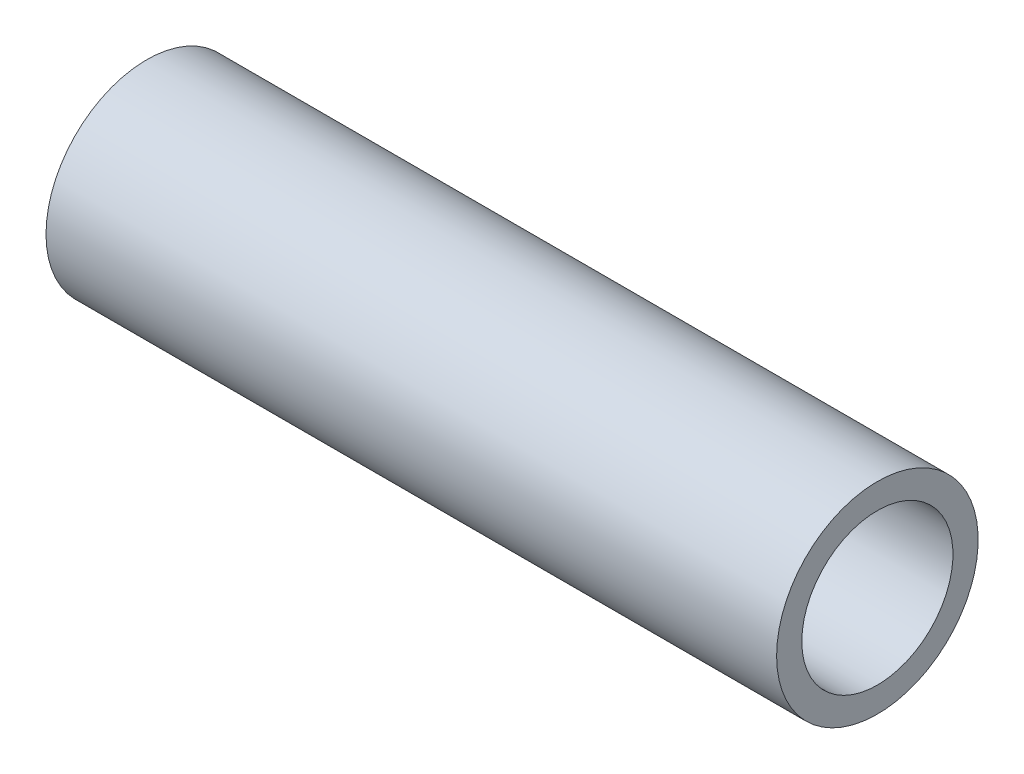
from build123d import *

# Parameters (mm, degrees)
TUBE_PROFILE_R   = 4
TUBE_PROFILE_R_2 = 3


with BuildPart() as part:
    # Tube: sweep along a curve in space
    with BuildLine() as tube_path:
        Line((167, 21, 40), (138, 21, 40))
    # Tube profile (on start of the path) → Tube (sweep)
    with BuildSketch(Plane(origin=(167, 21, 40), x_dir=(0, 0, -1), z_dir=(-1, 0, 0))):
        Circle(TUBE_PROFILE_R)
        Circle(TUBE_PROFILE_R_2, mode=Mode.SUBTRACT)
    sweep(path=tube_path.line)


solid = part.part
